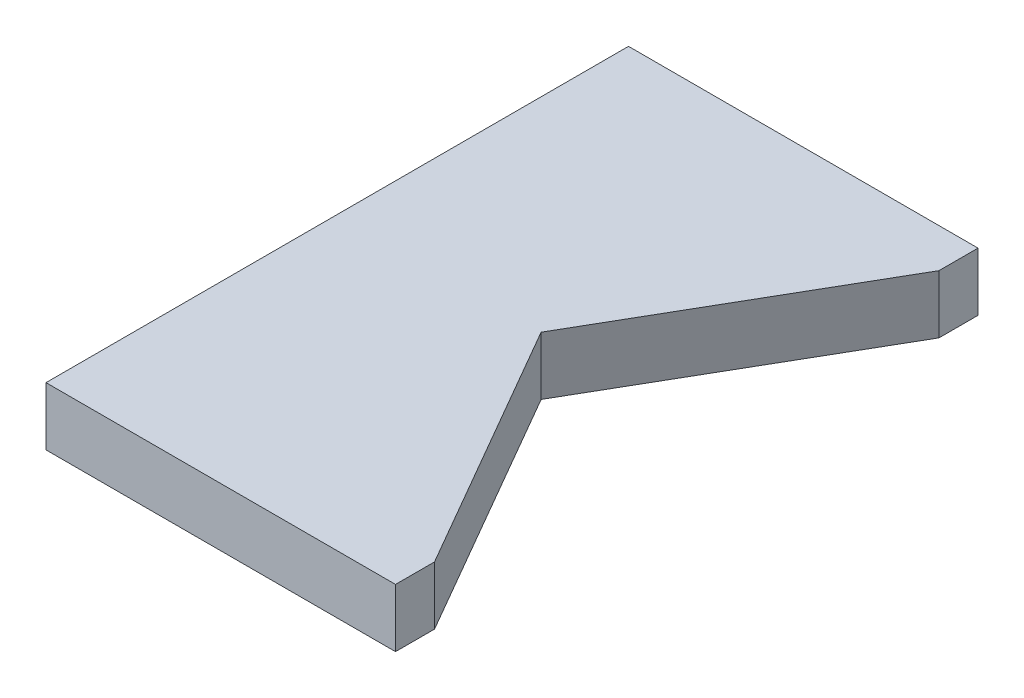
from build123d import *

# Parameters (mm, degrees)
BOSS_EXTRUDE1_DEPTH = 10


with BuildPart() as part:
    # Sketch1 → Boss-Extrude1 (new body)
    with BuildSketch(Plane(origin=(0, 0, 0), x_dir=(1, 0, 0), z_dir=(0, 1, 0))):
        Polygon((0, 0), (60, 0), (60, 6.7), (35, 50), (60, 93.3), (60, 100), (0, 100), align=None)
    extrude(amount=BOSS_EXTRUDE1_DEPTH)


solid = part.part
